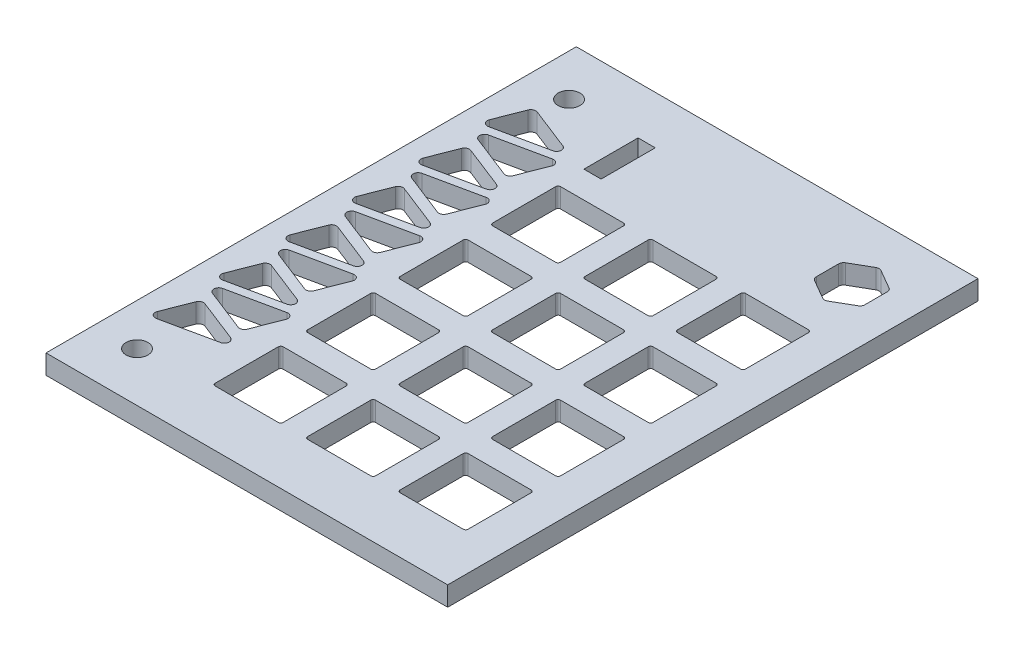
from build123d import *

# Parameters (mm, degrees)
SCHIZZO1_W                   = 82.75
SCHIZZO1_H                   = 109.25
SCHIZZO1_R                   = 2.25
ESTRUSIONE_ESTRUSIONE1_DEPTH = 4
TAGLIO_ESTRUSIONE1_DEPTH     = 19
SCHIZZO3_W                   = 3.54
SCHIZZO3_H                   = 11.16
TAGLIO_ESTRUSIONE2_DEPTH     = 19
TAGLIO_ESTRUSIONE3_DEPTH     = 19


with BuildPart() as part:
    # Schizzo1 → Estrusione-Estrusione1 (new body)
    with BuildSketch(Plane(origin=(0, 0, 0), x_dir=(1, 0, 0), z_dir=(0, 1, 0))):
        Rectangle(SCHIZZO1_W, SCHIZZO1_H)
        with Locations(Location((-32.75, 44.5, 0), (0, 0, 270))):
            Circle(SCHIZZO1_R, mode=Mode.SUBTRACT)
        with Locations(Location((-32.75, -44.5, 0), (0, 0, 270))):
            Circle(SCHIZZO1_R, mode=Mode.SUBTRACT)
    extrude(amount=ESTRUSIONE_ESTRUSIONE1_DEPTH)

    # Schizzo2 → Taglio-Estrusione1 (cut)
    with BuildSketch(Plane(origin=(0, 4, 0), x_dir=(1, 0, 0), z_dir=(0, 1, 0))):
        with BuildLine():
            Line((-18.05, 14.05), (-5.05, 14.05))
            ThreePointArc((-5.05, 14.05), (-4.696446609, 14.196446609), (-4.55, 14.55))
            Line((-4.55, 14.55), (-4.55, 27.55))
            ThreePointArc((-4.55, 27.55), (-4.696446609, 27.903553391), (-5.05, 28.05))
            Line((-5.05, 28.05), (-18.05, 28.05))
            ThreePointArc((-18.05, 28.05), (-18.403553391, 27.903553391), (-18.55, 27.55))
            Line((-18.55, 27.55), (-18.55, 14.55))
            ThreePointArc((-18.55, 14.55), (-18.403553391, 14.196446609), (-18.05, 14.05))
        make_face()
        with BuildLine():
            Line((1, 14.05), (14, 14.05))
            ThreePointArc((14, 14.05), (14.353553391, 14.196446609), (14.5, 14.55))
            Line((14.5, 14.55), (14.5, 27.55))
            ThreePointArc((14.5, 27.55), (14.353553391, 27.903553391), (14, 28.05))
            Line((14, 28.05), (1, 28.05))
            ThreePointArc((1, 28.05), (0.646446609, 27.903553391), (0.5, 27.55))
            Line((0.5, 27.55), (0.5, 14.55))
            ThreePointArc((0.5, 14.55), (0.646446609, 14.196446609), (1, 14.05))
        make_face()
        with BuildLine():
            Line((20.05, 14.05), (33.05, 14.05))
            ThreePointArc((33.05, 14.05), (33.403553391, 14.196446609), (33.55, 14.55))
            Line((33.55, 14.55), (33.55, 27.55))
            ThreePointArc((33.55, 27.55), (33.403553391, 27.903553391), (33.05, 28.05))
            Line((33.05, 28.05), (20.05, 28.05))
            ThreePointArc((20.05, 28.05), (19.696446609, 27.903553391), (19.55, 27.55))
            Line((19.55, 27.55), (19.55, 14.55))
            ThreePointArc((19.55, 14.55), (19.696446609, 14.196446609), (20.05, 14.05))
        make_face()
        with BuildLine():
            Line((20.05, -5), (33.05, -5))
            ThreePointArc((33.05, -5), (33.403553391, -4.853553391), (33.55, -4.5))
            Line((33.55, -4.5), (33.55, 8.5))
            ThreePointArc((33.55, 8.5), (33.403553391, 8.853553391), (33.05, 9))
            Line((33.05, 9), (20.05, 9))
            ThreePointArc((20.05, 9), (19.696446609, 8.853553391), (19.55, 8.5))
            Line((19.55, 8.5), (19.55, -4.5))
            ThreePointArc((19.55, -4.5), (19.696446609, -4.853553391), (20.05, -5))
        make_face()
        with BuildLine():
            Line((-18.05, -5), (-5.05, -5))
            ThreePointArc((-5.05, -5), (-4.696446609, -4.853553391), (-4.55, -4.5))
            Line((-4.55, -4.5), (-4.55, 8.5))
            ThreePointArc((-4.55, 8.5), (-4.696446609, 8.853553391), (-5.05, 9))
            Line((-5.05, 9), (-18.05, 9))
            ThreePointArc((-18.05, 9), (-18.403553391, 8.853553391), (-18.55, 8.5))
            Line((-18.55, 8.5), (-18.55, -4.5))
            ThreePointArc((-18.55, -4.5), (-18.403553391, -4.853553391), (-18.05, -5))
        make_face()
        with BuildLine():
            Line((1, -5), (14, -5))
            ThreePointArc((14, -5), (14.353553391, -4.853553391), (14.5, -4.5))
            Line((14.5, -4.5), (14.5, 8.5))
            ThreePointArc((14.5, 8.5), (14.353553391, 8.853553391), (14, 9))
            Line((14, 9), (1, 9))
            ThreePointArc((1, 9), (0.646446609, 8.853553391), (0.5, 8.5))
            Line((0.5, 8.5), (0.5, -4.5))
            ThreePointArc((0.5, -4.5), (0.646446609, -4.853553391), (1, -5))
        make_face()
        with BuildLine():
            Line((-18.05, -24.05), (-5.05, -24.05))
            ThreePointArc((-5.05, -24.05), (-4.696446609, -23.903553391), (-4.55, -23.55))
            Line((-4.55, -23.55), (-4.55, -10.55))
            ThreePointArc((-4.55, -10.55), (-4.696446609, -10.196446609), (-5.05, -10.05))
            Line((-5.05, -10.05), (-18.05, -10.05))
            ThreePointArc((-18.05, -10.05), (-18.403553391, -10.196446609), (-18.55, -10.55))
            Line((-18.55, -10.55), (-18.55, -23.55))
            ThreePointArc((-18.55, -23.55), (-18.403553391, -23.903553391), (-18.05, -24.05))
        make_face()
        with BuildLine():
            Line((1, -24.05), (14, -24.05))
            ThreePointArc((14, -24.05), (14.353553391, -23.903553391), (14.5, -23.55))
            Line((14.5, -23.55), (14.5, -10.55))
            ThreePointArc((14.5, -10.55), (14.353553391, -10.196446609), (14, -10.05))
            Line((14, -10.05), (1, -10.05))
            ThreePointArc((1, -10.05), (0.646446609, -10.196446609), (0.5, -10.55))
            Line((0.5, -10.55), (0.5, -23.55))
            ThreePointArc((0.5, -23.55), (0.646446609, -23.903553391), (1, -24.05))
        make_face()
        with BuildLine():
            Line((20.05, -24.05), (33.05, -24.05))
            ThreePointArc((33.05, -24.05), (33.403553391, -23.903553391), (33.55, -23.55))
            Line((33.55, -23.55), (33.55, -10.55))
            ThreePointArc((33.55, -10.55), (33.403553391, -10.196446609), (33.05, -10.05))
            Line((33.05, -10.05), (20.05, -10.05))
            ThreePointArc((20.05, -10.05), (19.696446609, -10.196446609), (19.55, -10.55))
            Line((19.55, -10.55), (19.55, -23.55))
            ThreePointArc((19.55, -23.55), (19.696446609, -23.903553391), (20.05, -24.05))
        make_face()
        with BuildLine():
            Line((20.05, -43.1), (33.05, -43.1))
            ThreePointArc((33.05, -43.1), (33.403553391, -42.953553391), (33.55, -42.6))
            Line((33.55, -42.6), (33.55, -29.6))
            ThreePointArc((33.55, -29.6), (33.403553391, -29.246446609), (33.05, -29.1))
            Line((33.05, -29.1), (20.05, -29.1))
            ThreePointArc((20.05, -29.1), (19.696446609, -29.246446609), (19.55, -29.6))
            Line((19.55, -29.6), (19.55, -42.6))
            ThreePointArc((19.55, -42.6), (19.696446609, -42.953553391), (20.05, -43.1))
        make_face()
        with BuildLine():
            Line((1, -43.1), (14, -43.1))
            ThreePointArc((14, -43.1), (14.353553391, -42.953553391), (14.5, -42.6))
            Line((14.5, -42.6), (14.5, -29.6))
            ThreePointArc((14.5, -29.6), (14.353553391, -29.246446609), (14, -29.1))
            Line((14, -29.1), (1, -29.1))
            ThreePointArc((1, -29.1), (0.646446609, -29.246446609), (0.5, -29.6))
            Line((0.5, -29.6), (0.5, -42.6))
            ThreePointArc((0.5, -42.6), (0.646446609, -42.953553391), (1, -43.1))
        make_face()
        with BuildLine():
            Line((-18.05, -43.1), (-5.05, -43.1))
            ThreePointArc((-5.05, -43.1), (-4.696446609, -42.953553391), (-4.55, -42.6))
            Line((-4.55, -42.6), (-4.55, -29.6))
            ThreePointArc((-4.55, -29.6), (-4.696446609, -29.246446609), (-5.05, -29.1))
            Line((-5.05, -29.1), (-18.05, -29.1))
            ThreePointArc((-18.05, -29.1), (-18.403553391, -29.246446609), (-18.55, -29.6))
            Line((-18.55, -29.6), (-18.55, -42.6))
            ThreePointArc((-18.55, -42.6), (-18.403553391, -42.953553391), (-18.05, -43.1))
        make_face()
    extrude(amount=-TAGLIO_ESTRUSIONE1_DEPTH, mode=Mode.SUBTRACT)

    # Schizzo3 → Taglio-Estrusione2 (cut)
    with BuildSketch(Plane(origin=(0, 4, 0), x_dir=(1, 0, 0), z_dir=(0, 1, 0))):
        with Locations((-16.9825, 39.1475)):
            Rectangle(SCHIZZO3_W, SCHIZZO3_H)
    extrude(amount=-TAGLIO_ESTRUSIONE2_DEPTH, mode=Mode.SUBTRACT)

    # Schizzo4 → Taglio-Estrusione3 (cut)
    with BuildSketch(Plane(origin=(0, 4, 0), x_dir=(1, 0, 0), z_dir=(0, 1, 0))):
        with BuildLine():
            Line((-35.058418758, -16.362591637), (-37.298179927, -22.083288058))
            ThreePointArc((-37.298179927, -22.083288058), (-37.129567671, -23.094775039), (-36.15909329, -23.426008314))
            Line((-36.15909329, -23.426008314), (-25.237271327, -21.104503391))
            ThreePointArc((-25.237271327, -21.104503391), (-24.448532263, -20.208131532), (-25.080610363, -19.195180845))
            Line((-25.080610363, -19.195180845), (-33.762671157, -15.795989347))
            ThreePointArc((-33.762671157, -15.795989347), (-34.527892134, -15.810932378), (-35.058418758, -16.362591637))
        make_face()
        with BuildLine():
            Line((-36.15909329, -37.114017113), (-25.237271327, -34.79251219))
            ThreePointArc((-25.237271327, -34.79251219), (-24.448532263, -33.896140331), (-25.080610363, -32.883189644))
            Line((-25.080610363, -32.883189644), (-33.762671157, -29.483998146))
            ThreePointArc((-33.762671157, -29.483998146), (-34.527892134, -29.498941177), (-35.058418758, -30.050600436))
            Line((-35.058418758, -30.050600436), (-37.298179927, -35.771296857))
            ThreePointArc((-37.298179927, -35.771296857), (-37.129567671, -36.782783838), (-36.15909329, -37.114017113))
        make_face()
        with BuildLine():
            Line((-34.869389637, -26.835330861), (-26.187328843, -30.234522358))
            ThreePointArc((-26.187328843, -30.234522358), (-25.422107866, -30.219579328), (-24.891581242, -29.667920068))
            Line((-24.891581242, -29.667920068), (-22.651820073, -23.947223647))
            ThreePointArc((-22.651820073, -23.947223647), (-22.820432329, -22.935736666), (-23.79090671, -22.604503391))
            Line((-23.79090671, -22.604503391), (-34.712728673, -24.926008314))
            ThreePointArc((-34.712728673, -24.926008314), (-35.501467737, -25.822380173), (-34.869389637, -26.835330861))
        make_face()
        with BuildLine():
            Line((-23.79090671, -8.916494592), (-34.712728673, -11.237999515))
            ThreePointArc((-34.712728673, -11.237999515), (-35.501467737, -12.134371374), (-34.869389637, -13.147322062))
            Line((-34.869389637, -13.147322062), (-26.187328843, -16.546513559))
            ThreePointArc((-26.187328843, -16.546513559), (-25.422107866, -16.531570529), (-24.891581242, -15.979911269))
            Line((-24.891581242, -15.979911269), (-22.651820073, -10.259214848))
            ThreePointArc((-22.651820073, -10.259214848), (-22.820432329, -9.247727867), (-23.79090671, -8.916494592))
        make_face()
        with BuildLine():
            Line((-35.058418758, -2.674582838), (-37.298179927, -8.395279259))
            ThreePointArc((-37.298179927, -8.395279259), (-37.129567671, -9.40676624), (-36.15909329, -9.737999515))
            Line((-36.15909329, -9.737999515), (-25.237271327, -7.416494592))
            ThreePointArc((-25.237271327, -7.416494592), (-24.448532263, -6.520122733), (-25.080610363, -5.507172046))
            Line((-25.080610363, -5.507172046), (-33.762671157, -2.107980548))
            ThreePointArc((-33.762671157, -2.107980548), (-34.527892134, -2.122923579), (-35.058418758, -2.674582838))
        make_face()
        with BuildLine():
            Line((-23.79090671, 4.771514207), (-34.712728673, 2.450009284))
            ThreePointArc((-34.712728673, 2.450009284), (-35.501467737, 1.553637425), (-34.869389637, 0.540686737))
            Line((-34.869389637, 0.540686737), (-26.187328843, -2.85850476))
            ThreePointArc((-26.187328843, -2.85850476), (-25.422107866, -2.84356173), (-24.891581242, -2.29190247))
            Line((-24.891581242, -2.29190247), (-22.651820073, 3.428793951))
            ThreePointArc((-22.651820073, 3.428793951), (-22.820432329, 4.440280932), (-23.79090671, 4.771514207))
        make_face()
        with BuildLine():
            Line((-35.058418758, 11.013425961), (-37.298179927, 5.29272954))
            ThreePointArc((-37.298179927, 5.29272954), (-37.129567671, 4.281242559), (-36.15909329, 3.950009284))
            Line((-36.15909329, 3.950009284), (-25.237271327, 6.271514207))
            ThreePointArc((-25.237271327, 6.271514207), (-24.448532263, 7.167886066), (-25.080610363, 8.180836753))
            Line((-25.080610363, 8.180836753), (-33.762671157, 11.580028251))
            ThreePointArc((-33.762671157, 11.580028251), (-34.527892134, 11.565085221), (-35.058418758, 11.013425961))
        make_face()
        with BuildLine():
            Line((-23.79090671, 18.459523006), (-34.712728673, 16.138018083))
            ThreePointArc((-34.712728673, 16.138018083), (-35.501467737, 15.241646224), (-34.869389637, 14.228695536))
            Line((-34.869389637, 14.228695536), (-26.187328843, 10.829504039))
            ThreePointArc((-26.187328843, 10.829504039), (-25.422107866, 10.844447069), (-24.891581242, 11.396106329))
            Line((-24.891581242, 11.396106329), (-22.651820073, 17.11680275))
            ThreePointArc((-22.651820073, 17.11680275), (-22.820432329, 18.128289731), (-23.79090671, 18.459523006))
        make_face()
        with BuildLine():
            Line((-35.058418758, 24.70143476), (-37.298179927, 18.980738339))
            ThreePointArc((-37.298179927, 18.980738339), (-37.129567671, 17.969251358), (-36.15909329, 17.638018083))
            Line((-36.15909329, 17.638018083), (-25.237271327, 19.959523006))
            ThreePointArc((-25.237271327, 19.959523006), (-24.448532263, 20.855894865), (-25.080610363, 21.868845552))
            Line((-25.080610363, 21.868845552), (-33.762671157, 25.26803705))
            ThreePointArc((-33.762671157, 25.26803705), (-34.527892134, 25.25309402), (-35.058418758, 24.70143476))
        make_face()
        with BuildLine():
            Line((-23.79090671, 32.147531805), (-34.712728673, 29.826026882))
            ThreePointArc((-34.712728673, 29.826026882), (-35.501467737, 28.929655023), (-34.869389637, 27.916704335))
            Line((-34.869389637, 27.916704335), (-26.187328843, 24.517512838))
            ThreePointArc((-26.187328843, 24.517512838), (-25.422107866, 24.532455868), (-24.891581242, 25.084115128))
            Line((-24.891581242, 25.084115128), (-22.651820073, 30.804811549))
            ThreePointArc((-22.651820073, 30.804811549), (-22.820432329, 31.81629853), (-23.79090671, 32.147531805))
        make_face()
        with BuildLine():
            Line((-35.058418758, 38.389443559), (-37.298179927, 32.668747138))
            ThreePointArc((-37.298179927, 32.668747138), (-37.129567671, 31.657260157), (-36.15909329, 31.326026882))
            Line((-36.15909329, 31.326026882), (-25.237271327, 33.647531805))
            ThreePointArc((-25.237271327, 33.647531805), (-24.448532263, 34.543903664), (-25.080610363, 35.556854351))
            Line((-25.080610363, 35.556854351), (-33.762671157, 38.956045849))
            ThreePointArc((-33.762671157, 38.956045849), (-34.527892134, 38.941102819), (-35.058418758, 38.389443559))
        make_face()
        with BuildLine():
            Line((28.875, 46.109827557), (24.875, 43.800426481))
            ThreePointArc((24.875, 43.800426481), (24.508974596, 43.434401077), (24.375, 42.934401077))
            Line((24.375, 42.934401077), (24.375, 38.315598923))
            ThreePointArc((24.375, 38.315598923), (24.508974596, 37.815598923), (24.875, 37.449573519))
            Line((24.875, 37.449573519), (28.875, 35.140172443))
            ThreePointArc((28.875, 35.140172443), (29.375, 35.006197846), (29.875, 35.140172443))
            Line((29.875, 35.140172443), (33.875, 37.449573519))
            ThreePointArc((33.875, 37.449573519), (34.241025404, 37.815598923), (34.375, 38.315598923))
            Line((34.375, 38.315598923), (34.375, 42.934401077))
            ThreePointArc((34.375, 42.934401077), (34.241025404, 43.434401077), (33.875, 43.800426481))
            Line((33.875, 43.800426481), (29.875, 46.109827557))
            ThreePointArc((29.875, 46.109827557), (29.375, 46.243802154), (28.875, 46.109827557))
        make_face()
    extrude(amount=-TAGLIO_ESTRUSIONE3_DEPTH, mode=Mode.SUBTRACT)


solid = part.part
